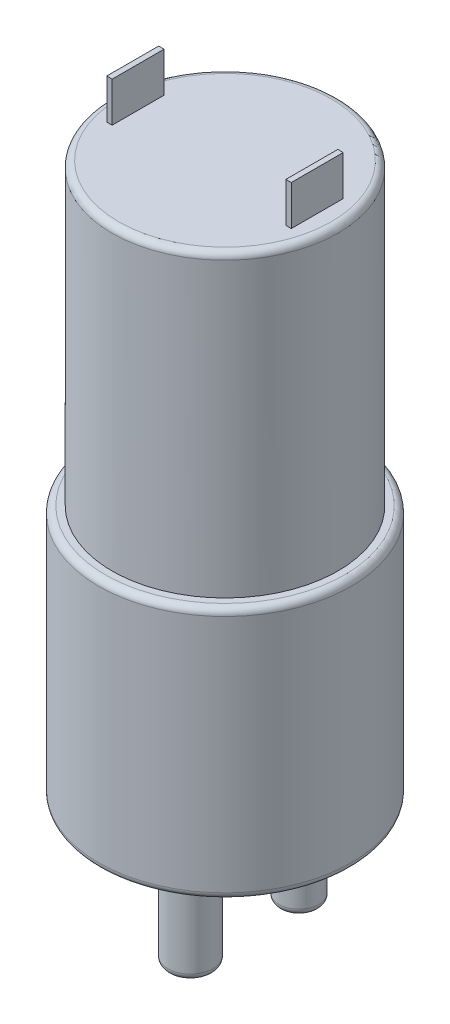
from build123d import *

# Parameters (mm, degrees)
SKETCH_1_R      = 8.5
EXTRUDE_1_DEPTH = 22.5
SKETCH_2_R      = 9.5
EXTRUDE_2_DEPTH = 19
SKETCH_3_R      = 1.7
SKETCH_3_R_2    = 0.2
SKETCH_3_R_3    = 1.5
SKETCH_3_R_4    = 0.1
EXTRUDE_3_DEPTH = 9.5
SKETCH_4_W      = 0.406968973
SKETCH_4_H      = 3.906902144
EXTRUDE_4_DEPTH = 3
FILLET_2_R      = 0.5


with BuildPart() as part:
    # 草图1 → 凸台-拉伸1 (new body)
    with BuildSketch(Plane(origin=(0, 0, 0), x_dir=(1, 0, 0), z_dir=(0, 1, 0))):
        with Locations(Location((0, 0, 0), (0, 0, 90))):
            Circle(SKETCH_1_R)
    extrude(amount=EXTRUDE_1_DEPTH)

    # 草图2 → 凸台-拉伸2 (add)
    with BuildSketch(Plane.XZ):
        with Locations(Location((0, 0, 0), (0, 0, 270))):
            Circle(SKETCH_2_R)
    extrude(amount=EXTRUDE_2_DEPTH)

    # 草图3 → 凸台-拉伸3 (add)
    # profile 1 of 2: a face of its own
    with BuildSketch(Plane.XZ.offset(19)):
        with Locations(Location((0, 2.6, 0), (0, 0, 270))):
            Circle(SKETCH_3_R)
        with Locations(Location((0, 2.6, 0), (0, 0, 270))):
            Circle(SKETCH_3_R_2, mode=Mode.SUBTRACT)
    # profile 2 of 2: a face of its own
    with BuildSketch(Plane.XZ.offset(19)):
        with Locations(Location((0, -5.563865297, 0), (0, 0, 270))):
            Circle(SKETCH_3_R_3)
        with Locations(Location((0, -5.563865297, 0), (0, 0, 270))):
            Circle(SKETCH_3_R_4, mode=Mode.SUBTRACT)
    extrude(amount=EXTRUDE_3_DEPTH)

    # 草图4 → 凸台-拉伸4 (add)
    with BuildSketch(Plane(origin=(0, 22.5, 0), x_dir=(1, 0, 0), z_dir=(0, 1, 0))):
        with Locations((-6.735336509, 0)):
            Rectangle(SKETCH_4_W, SKETCH_4_H)
        with Locations((6.735336509, 0)):
            Rectangle(SKETCH_4_W, SKETCH_4_H)
    extrude(amount=EXTRUDE_4_DEPTH)

    # 圆角2
    fillet_2_edges = [part.edges().sort_by_distance(p)[0] for p in [
        (0, -19, 4.3),
        (0, -28.5, 4.3),
        (0, -28.5, -4.063865297),
        (0, -19, -4.063865297),
        (0, 22.5, 8.5),
        (0, 0, 9.5),
        (0, -19, 9.5),
    ]]
    fillet(fillet_2_edges, radius=FILLET_2_R)


solid = part.part
